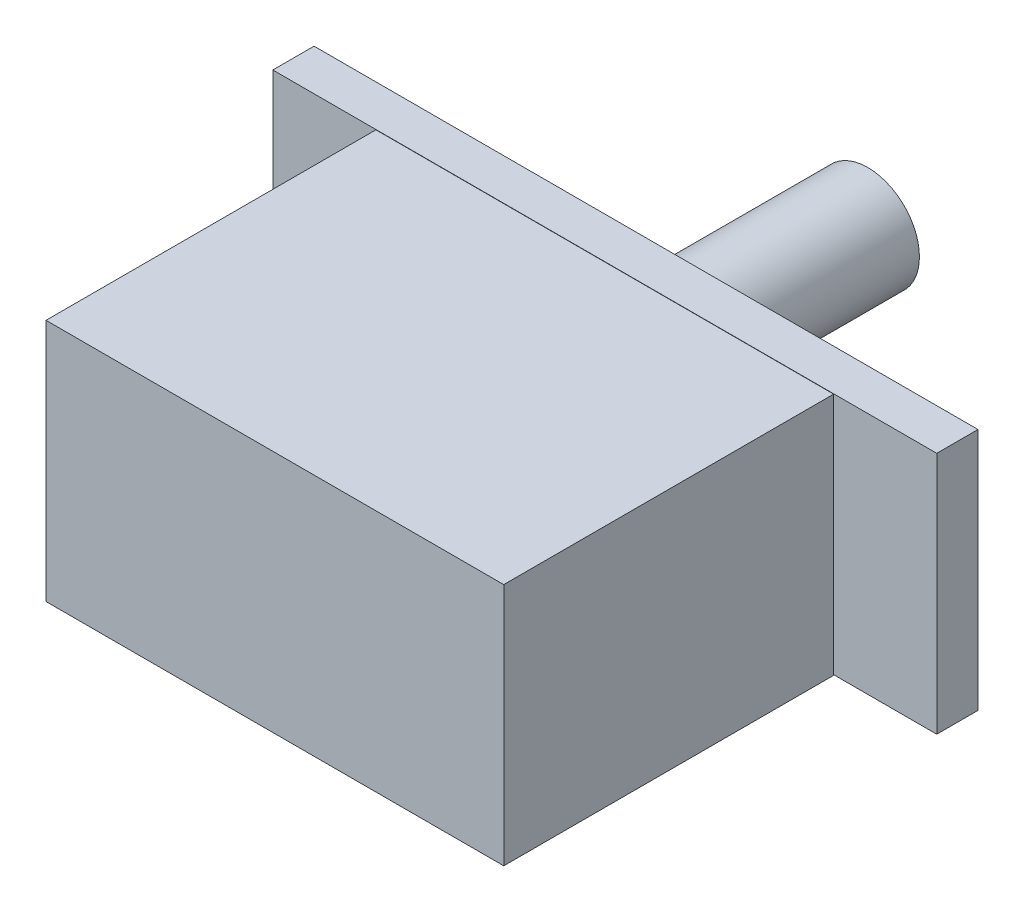
from build123d import *

# Parameters (mm, degrees)
ESBO_O1_W                = 32.2
ESBO_O1_H                = 11.8
RESSALTO_EXTRUS_O1_DEPTH = 2
ESBO_O2_W                = 22.2
ESBO_O2_H                = 11.812594062
RESSALTO_EXTRUS_O2_DEPTH = 16
ESBO_O3_R                = 2.5
RESSALTO_EXTRUS_O3_DEPTH = 12


with BuildPart() as part:
    # Esboço1 → Ressalto-extrusão1 (new body)
    with BuildSketch(Plane.XY):
        with Locations((-49.254652801, -12.977504244)):
            Rectangle(ESBO_O1_W, ESBO_O1_H)
    extrude(amount=RESSALTO_EXTRUS_O1_DEPTH)

    # Esboço2 → Ressalto-extrusão2 (add)
    with BuildSketch(Plane.XY.offset(2)):
        with Locations((-49.254652801, -12.997877007)):
            Rectangle(ESBO_O2_W, ESBO_O2_H)
    extrude(amount=RESSALTO_EXTRUS_O2_DEPTH)

    # Esboço3 → Ressalto-extrusão3 (add)
    with BuildSketch(Plane(origin=(0, 0, 0), x_dir=(-1, 0, 0), z_dir=(0, 0, -1))):
        with Locations(Location((50.495961023, -13.245250528, 0), (0, 0, 180))):
            Circle(ESBO_O3_R)
    extrude(amount=RESSALTO_EXTRUS_O3_DEPTH)


solid = part.part
